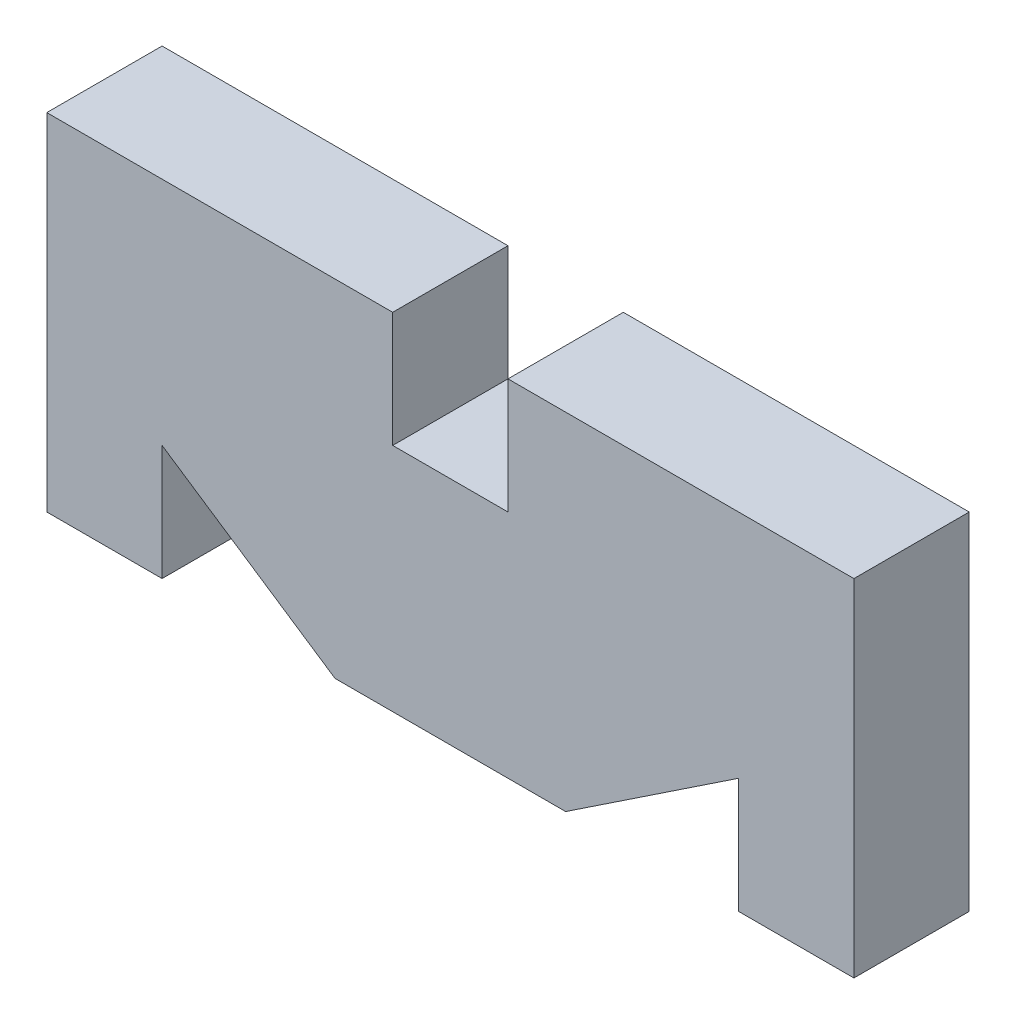
from build123d import *

# Parameters (mm, degrees)
BOSS_EXTRUDE1_DEPTH = 10


with BuildPart() as part:
    # Sketch1 → Boss-Extrude1 (new body)
    with BuildSketch(Plane.XY):
        Polygon((5, 15), (35, 15), (35, -15), (25, -15), (25, -5), (10, -15), (-10, -15), (-25, -5), (-25, -15), (-35, -15), (-35, 15), (-5, 15), (-5, 5), (5, 5), align=None)
    extrude(amount=BOSS_EXTRUDE1_DEPTH)


solid = part.part
